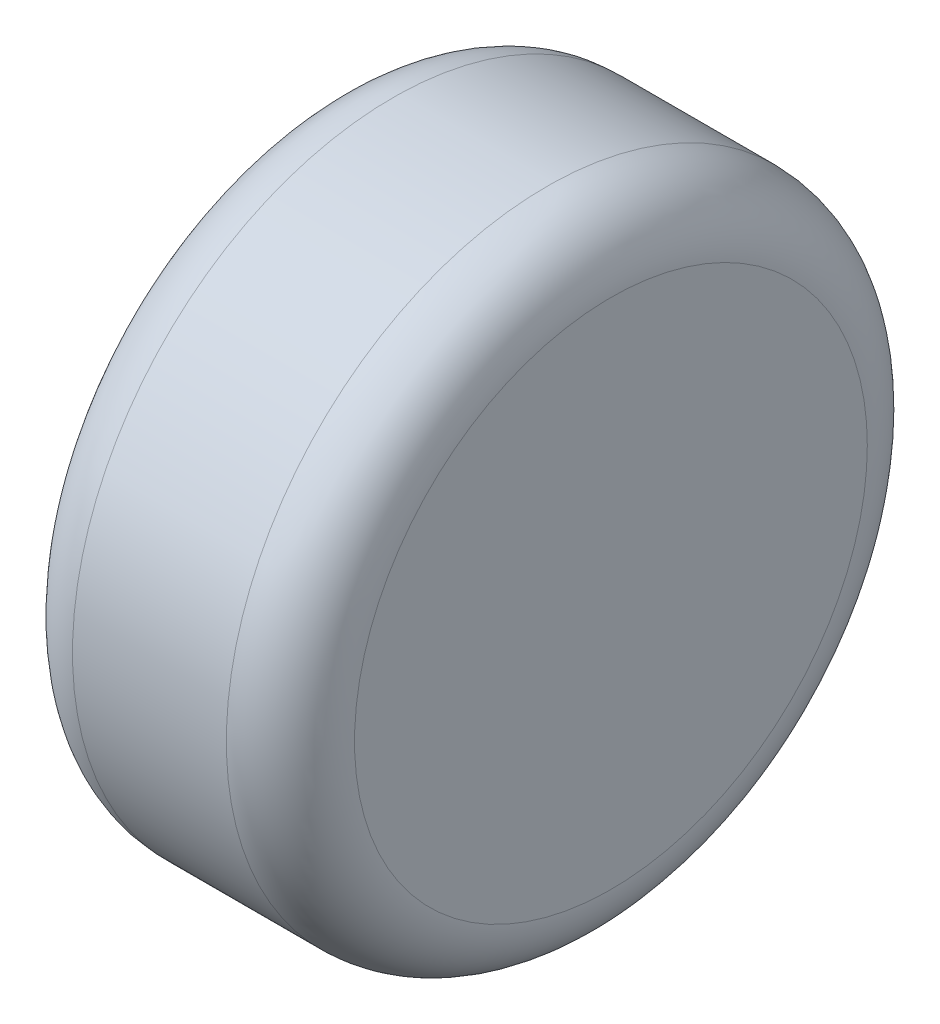
from build123d import *

# Parameters (mm, degrees)
SKETCH1_R           = 63.5
BOSS_EXTRUDE1_DEPTH = 55.88
FILLET1_R           = 12.7


with BuildPart() as part:
    # Sketch1 → Boss-Extrude1 (new body)
    with BuildSketch(Plane(origin=(0, 0, 0), x_dir=(0, 0, -1), z_dir=(1, 0, 0))):
        Circle(SKETCH1_R)
    extrude(amount=BOSS_EXTRUDE1_DEPTH)

    # Fillet1
    fillet1_edges = [part.edges().sort_by_distance(p)[0] for p in [
        (0, 0, 63.5),
        (55.88, 0, 63.5),
    ]]
    fillet(fillet1_edges, radius=FILLET1_R)


solid = part.part
